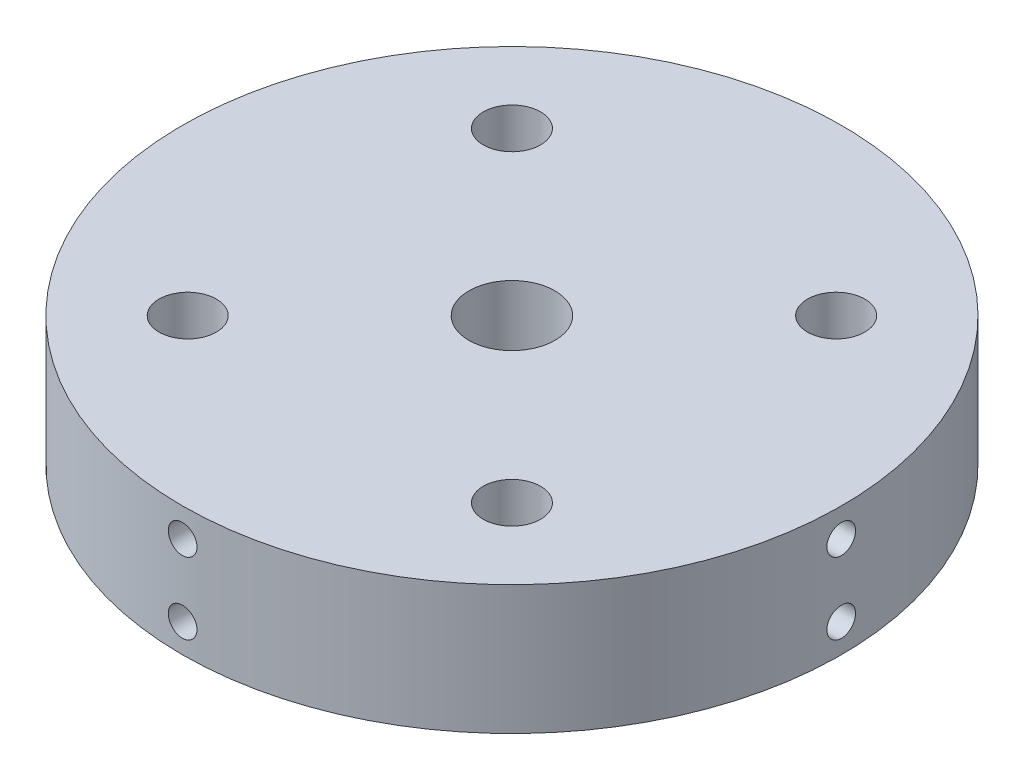
from build123d import *

# Parameters (mm, degrees)
SKETCH1_R           = 73.025
BOSS_EXTRUDE1_DEPTH = 28.575
SKETCH2_R           = 9.525
CUT_EXTRUDE1_DEPTH  = 108.153310145
SKETCH30_R          = 3.175
CUT_EXTRUDE2_DEPTH  = 25.4
CIRPATTERN3_COUNT   = 4
SKETCH31_R          = 6.35
CUT_EXTRUDE3_DEPTH  = 108.153310308
CIRPATTERN4_COUNT   = 4


with BuildPart() as part:
    # Sketch1 → Boss-Extrude1 (new body)
    with BuildSketch(Plane(origin=(0, 0, 0), x_dir=(1, 0, 0), z_dir=(0, 1, 0))):
        with Locations(Location((0, 0, 0), (0, 0, 270))):
            Circle(SKETCH1_R)
    extrude(amount=BOSS_EXTRUDE1_DEPTH)

    # Sketch2 → Cut-Extrude1 (cut, through all)
    with BuildSketch(Plane(origin=(0, 28.575, 0), x_dir=(1, 0, 0), z_dir=(0, 1, 0))):
        with Locations(Location((0, 0, 0), (0, 0, 270))):
            Circle(SKETCH2_R)
    extrude(amount=-CUT_EXTRUDE1_DEPTH, mode=Mode.SUBTRACT)

    # Sketch30 → Cut-Extrude2 (cut)
    with BuildSketch(Plane.XY.offset(73.025)):
        with Locations((0, 22.225)):
            Circle(SKETCH30_R)
        with Locations((0, 6.35)):
            Circle(SKETCH30_R)
    cut_extrude2 = extrude(amount=-CUT_EXTRUDE2_DEPTH, mode=Mode.SUBTRACT)

    # CirPattern3: Cut-Extrude2 ×4 about axis
    cirpattern3_axis = Axis((0, 0, 0), (0, 1, 0))
    for i in range(1, CIRPATTERN3_COUNT):
        add(cut_extrude2.rotate(cirpattern3_axis, i * 360 / CIRPATTERN3_COUNT), mode=Mode.SUBTRACT)

    # Sketch31 → Cut-Extrude3 (cut, through all)
    with BuildSketch(Plane(origin=(0, 28.575, 0), x_dir=(1, 0, 0), z_dir=(0, 1, 0))):
        with Locations(Location((35.921024484, 35.921024484, 0), (0, 0, 270))):
            Circle(SKETCH31_R)
    cut_extrude3 = extrude(amount=-CUT_EXTRUDE3_DEPTH, mode=Mode.SUBTRACT)

    # CirPattern4: Cut-Extrude3 ×4 about axis
    cirpattern4_axis = Axis((0, 0, 0), (0, 1, 0))
    for i in range(1, CIRPATTERN4_COUNT):
        add(cut_extrude3.rotate(cirpattern4_axis, i * 360 / CIRPATTERN4_COUNT), mode=Mode.SUBTRACT)


solid = part.part
